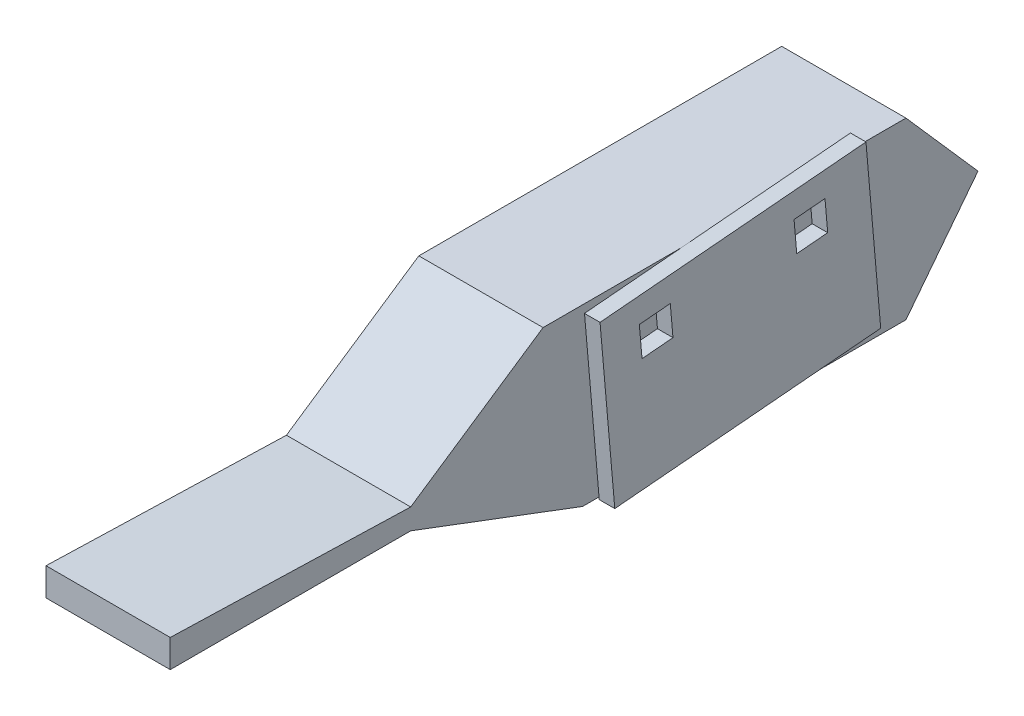
from build123d import *

# Parameters (mm, degrees)
BOSS_EXTRUDE1_DEPTH = 12.7
BOSS_EXTRUDE2_DEPTH = 3.175


with BuildPart() as part:
    # Sketch1 → Boss-Extrude1 (new, symmetric)
    with BuildSketch(Plane(origin=(0, 0, 0), x_dir=(0, 0, -1), z_dir=(1, 0, 0))):
        Polygon((-68.297268412, 0), (-41.236086589, 18.224877555), (32.952051336, 18.224877555), (47.679225118, 1.472717378), (32.952051336, -17.488518866), (-33.136141009, -17.488518866), (-68.297268412, -4.234062462), (-117.449210909, -4.234062462), (-117.449210909, 1.472717378), align=None)
    extrude(amount=BOSS_EXTRUDE1_DEPTH, both=True)

    # Sketch2 → Boss-Extrude2 (add)
    with BuildSketch(Plane(origin=(12.7, 0, 0), x_dir=(0, 0, -1), z_dir=(1, 0, 0))):
        Polygon((-29.747162431, -17.985294415), (24.617608562, -13.228993258), (21.600184439, 21.260322286), (-32.764586554, 16.504021128), align=None)
        Polygon((-24.177392815, 5.781642489), (-17.851556482, 6.335081455), (-18.404995449, 12.660917788), (-24.730831781, 12.107478822), align=None, mode=Mode.SUBTRACT)
        Polygon((7.451788849, 8.548837321), (13.777625182, 9.102276288), (13.224186216, 15.428112621), (6.898349883, 14.874673654), align=None, mode=Mode.SUBTRACT)
    extrude(amount=BOSS_EXTRUDE2_DEPTH)


solid = part.part
